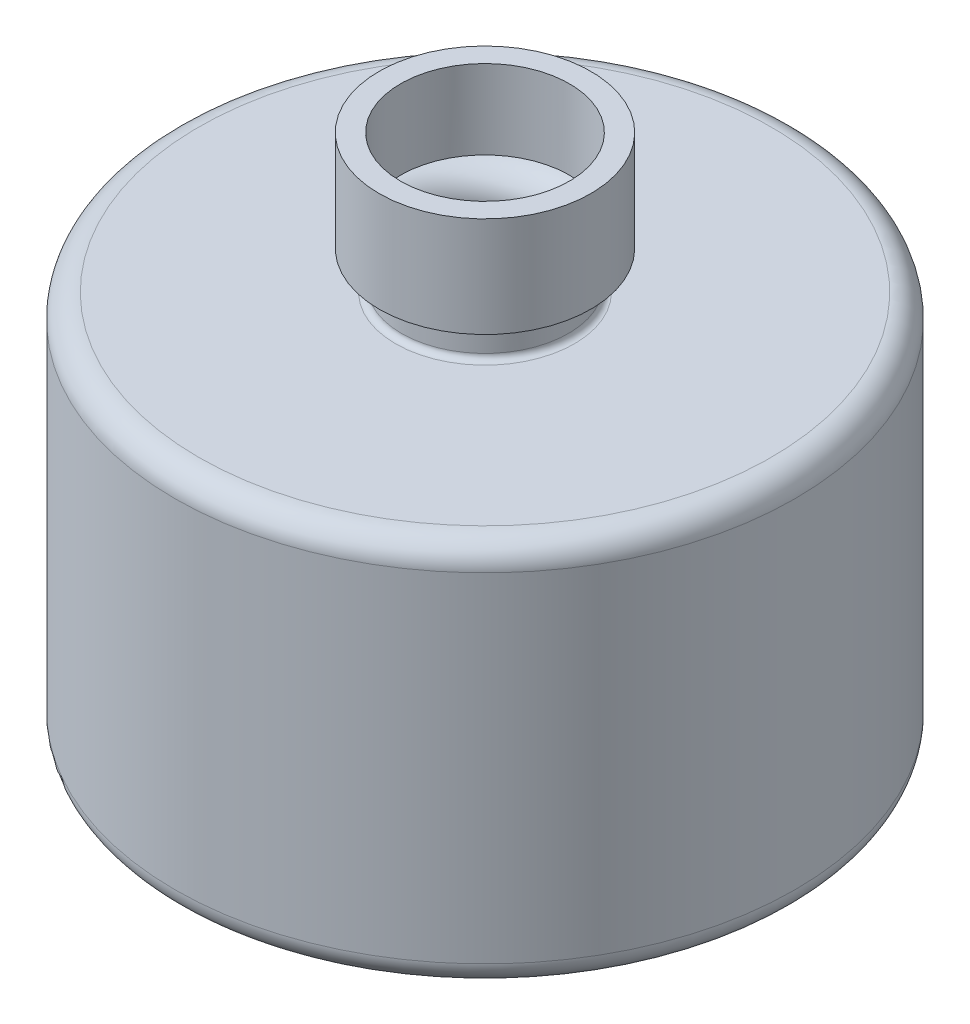
from build123d import *

# Parameters (mm, degrees)
FILLET1_R = 1.27
FILLET2_R = 0.3175
FILLET3_R = 0.3175
SHELL1_T  = -1.143


with BuildPart() as part:
    # Sketch1 → Revolve1 (revolve)
    with BuildSketch(Plane.XY, mode=Mode.PRIVATE) as revolve1_sk:
        Polygon((0, 0), (-16.51, 0), (-16.51, 20.574), (-4.445, 20.574), (-4.445, 22.606), (-5.6388, 22.606), (-5.6388, 27.94), (0, 27.94), align=None)
    revolve(revolve1_sk.sketch.rotate(Axis((0, 27.94, 0), (0, -1, 0)), 270), axis=Axis((0, 27.94, 0), (0, -1, 0)))

    # Fillet1
    fillet1_edges = [part.edges().sort_by_distance(p)[0] for p in [
        (0, 20.574, -16.51),
        (0, 0, -16.51),
    ]]
    fillet(fillet1_edges, radius=FILLET1_R)

    # Fillet2
    fillet2_edges = [part.edges().sort_by_distance(p)[0] for p in [
        (0, 20.574, -4.445),
    ]]
    fillet(fillet2_edges, radius=FILLET2_R)

    # Fillet3
    fillet3_edges = [part.edges().sort_by_distance(p)[0] for p in [
        (0, 22.606, -4.445),
    ]]
    fillet(fillet3_edges, radius=FILLET3_R)

    # Shell1
    shell1_openings = [part.faces().sort_by_distance(p)[0] for p in [
        (0, 27.94, 0),
    ]]
    offset(amount=SHELL1_T, openings=shell1_openings)


solid = part.part
